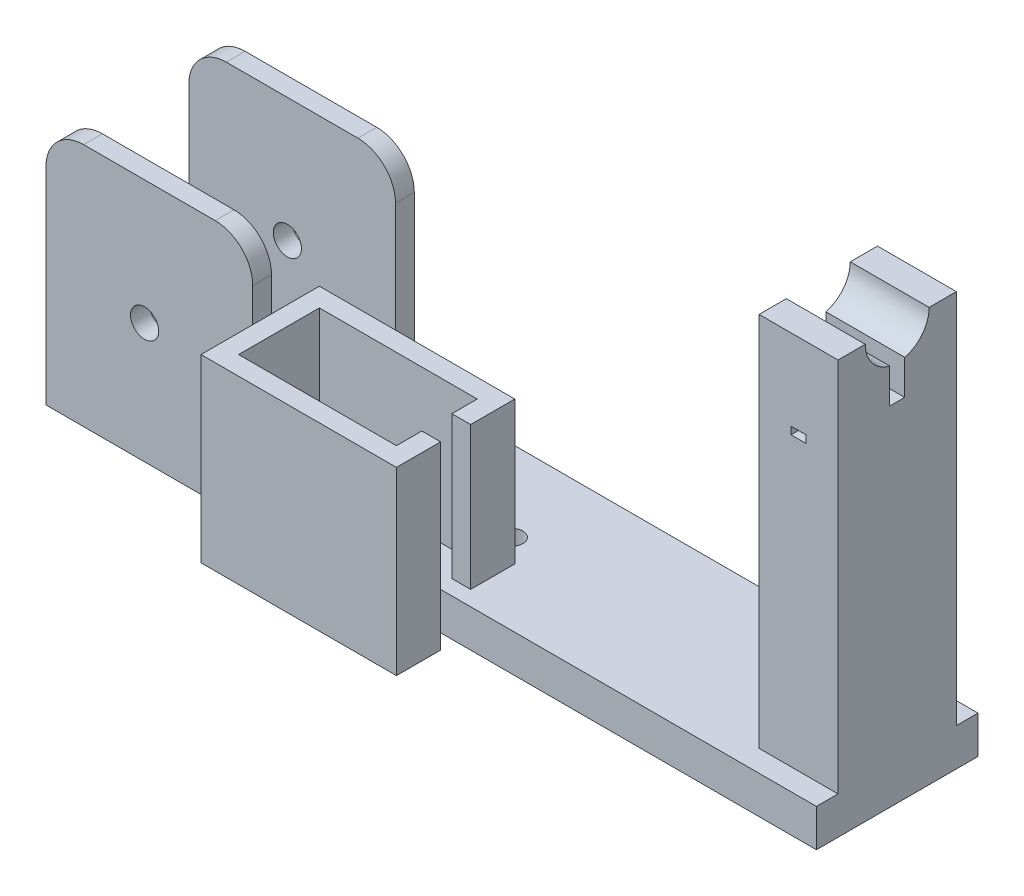
from build123d import *

# Parameters (mm, degrees)
SKETCH1_W           = 205
SKETCH1_H           = 43
BOSS_EXTRUDE1_DEPTH = 10
SKETCH4_W           = 55
SKETCH4_H           = 5
BOSS_EXTRUDE2_DEPTH = 55
SKETCH5_W           = 21
SKETCH5_H           = 31.5
BARREL_STAND_DEPTH  = 100
CUT_EXTRUDE4_DEPTH  = 21
SKETCH7_R           = 3.75
BOLT_HOLE_DEPTH     = 197.370661061
FILLET3_R           = 10
CUT_EXTRUDE9_DEPTH  = 2.8
SKETCH12_R          = 2.9
CUT_EXTRUDE10_DEPTH = 10
SKETCH13_W          = 4
SKETCH13_H          = 2
ZIP_TIE_SLOT_DEPTH  = 196.192210464
BOSS_EXTRUDE3_DEPTH = 38
BOSS_EXTRUDE4_DEPTH = 10


with BuildPart() as part:
    # Sketch1 → Boss-Extrude1 (new body)
    with BuildSketch(Plane(origin=(0, 0, 0), x_dir=(1, 0, 0), z_dir=(0, 1, 0))):
        with Locations((-54.3835126, 22.064427358)):
            Rectangle(SKETCH1_W, SKETCH1_H)
    extrude(amount=BOSS_EXTRUDE1_DEPTH)

    # Sketch4 → Boss-Extrude2 (add)
    with BuildSketch(Plane(origin=(0, 10, 0), x_dir=(1, 0, 0), z_dir=(0, 1, 0))):
        with Locations((-129.3835126, 3.064427358)):
            Rectangle(SKETCH4_W, SKETCH4_H)
    boss_extrude2 = extrude(amount=BOSS_EXTRUDE2_DEPTH)

    # Mirror1: Boss-Extrude2 across plane
    add(boss_extrude2.mirror(Plane.XY.offset(-22.064427358)))

    # Sketch5 → Barrel Stand (add)
    with BuildSketch(Plane(origin=(0, 10, 0), x_dir=(1, 0, 0), z_dir=(0, 1, 0))):
        with Locations((37.6164874, 22.064427358)):
            Rectangle(SKETCH5_W, SKETCH5_H)
    extrude(amount=BARREL_STAND_DEPTH)

    # Sketch6 → Cut-Extrude4 (cut)
    with BuildSketch(Plane(origin=(48.1164874, 0, 10.302060042), x_dir=(0, 0, 1), z_dir=(-1, 0, 0))):
        with BuildLine():
            Line((-34.3664874, 92.5), (-30.3664874, 92.5))
            Line((-30.3664874, 92.5), (-30.3664874, 101.738644179))
            ThreePointArc((-30.3664874, 101.738644179), (-32.3664874, 118.5), (-34.3664874, 101.738644179))
            Line((-34.3664874, 101.738644179), (-34.3664874, 92.5))
        make_face()
    extrude(amount=CUT_EXTRUDE4_DEPTH, mode=Mode.SUBTRACT)

    # Sketch7 → Bolt Hole (cut, through all)
    with BuildSketch(Plane.XY.offset(-0.564427358)):
        with Locations((-130.656969182, 32)):
            Circle(SKETCH7_R)
    extrude(amount=-BOLT_HOLE_DEPTH, mode=Mode.SUBTRACT)

    # Fillet3
    fillet3_edges = [part.edges().sort_by_distance(p)[0] for p in [
        (-156.8835126, 65, -3.064427358),
        (-101.8835126, 65, -3.064427358),
        (-156.8835126, 65, -41.064427358),
        (-101.8835126, 65, -41.064427358),
    ]]
    fillet(fillet3_edges, radius=FILLET3_R)

    # Sketch11 → Cut-Extrude9 (cut)
    # profile 1 of 2: a face of its own
    with BuildSketch(Plane.XZ):
        with BuildLine():
            Line((-40.210281565, -12.15972992), (-46.639894467, -20.689656856))
            ThreePointArc((-46.639894467, -20.689656856), (-47.433748895, -22.064427358), (-46.639894467, -23.43919786))
            Line((-46.639894467, -23.43919786), (-40.210281565, -31.969124796))
            ThreePointArc((-40.210281565, -31.969124796), (-40.489047819, -35.959259074), (-44.479189458, -36.237919954))
            Line((-44.479189458, -36.237919954), (-53.008957608, -29.808073492))
            ThreePointArc((-53.008957608, -29.808073492), (-54.3835126, -29.014191063), (-55.758067592, -29.808073492))
            Line((-55.758067592, -29.808073492), (-64.287835742, -36.237919954))
            ThreePointArc((-64.287835742, -36.237919954), (-68.277977381, -35.959259074), (-68.556743635, -31.969124796))
            Line((-68.556743635, -31.969124796), (-62.127130733, -23.43919786))
            ThreePointArc((-62.127130733, -23.43919786), (-61.333276305, -22.064427358), (-62.127130733, -20.689656856))
            Line((-62.127130733, -20.689656856), (-68.556743635, -12.15972992))
            ThreePointArc((-68.556743635, -12.15972992), (-68.277977381, -8.169595641), (-64.287835742, -7.890934761))
            Line((-64.287835742, -7.890934761), (-55.758067592, -14.320781224))
            ThreePointArc((-55.758067592, -14.320781224), (-54.3835126, -15.114663653), (-53.008957608, -14.320781224))
            Line((-53.008957608, -14.320781224), (-44.479189458, -7.890934761))
            ThreePointArc((-44.479189458, -7.890934761), (-40.489047819, -8.169595641), (-40.210281565, -12.15972992))
        make_face()
        with BuildLine():
            ThreePointArc((-52.857065356, -14.456741186), (-54.3835126, -15.314663653), (-55.909959844, -14.456741186))
            Line((-55.909959844, -14.456741186), (-64.40822508, -8.050642017))
            ThreePointArc((-64.40822508, -8.050642017), (-68.136557893, -8.311018864), (-68.3970332, -12.0393448))
            Line((-68.3970332, -12.0393448), (-61.991158458, -20.537779207))
            ThreePointArc((-61.991158458, -20.537779207), (-61.133276305, -22.064427358), (-61.991158458, -23.591075508))
            Line((-61.991158458, -23.591075508), (-68.3970332, -32.089509915))
            ThreePointArc((-68.3970332, -32.089509915), (-68.136557893, -35.817835851), (-64.40822508, -36.078212699))
            Line((-64.40822508, -36.078212699), (-55.909959844, -29.672113529))
            ThreePointArc((-55.909959844, -29.672113529), (-54.3835126, -28.814191063), (-52.857065356, -29.672113529))
            Line((-52.857065356, -29.672113529), (-44.35880012, -36.078212699))
            ThreePointArc((-44.35880012, -36.078212699), (-40.630467307, -35.817835851), (-40.369992, -32.089509915))
            Line((-40.369992, -32.089509915), (-46.775866742, -23.591075508))
            ThreePointArc((-46.775866742, -23.591075508), (-47.633748895, -22.064427358), (-46.775866742, -20.537779207))
            Line((-46.775866742, -20.537779207), (-40.369992, -12.0393448))
            ThreePointArc((-40.369992, -12.0393448), (-40.630467307, -8.311018864), (-44.35880012, -8.050642017))
            Line((-44.35880012, -8.050642017), (-52.857065356, -14.456741186))
        make_face(mode=Mode.SUBTRACT)
    # profile 2 of 2: a face of its own
    with BuildSketch(Plane.XZ):
        with BuildLine():
            Line((-44.35880012, -8.050642017), (-52.857065356, -14.456741186))
            ThreePointArc((-52.857065356, -14.456741186), (-54.3835126, -15.314663653), (-55.909959844, -14.456741186))
            Line((-55.909959844, -14.456741186), (-64.40822508, -8.050642017))
            ThreePointArc((-64.40822508, -8.050642017), (-68.136557893, -8.311018864), (-68.3970332, -12.0393448))
            Line((-68.3970332, -12.0393448), (-61.991158458, -20.537779207))
            ThreePointArc((-61.991158458, -20.537779207), (-61.133276305, -22.064427358), (-61.991158458, -23.591075508))
            Line((-61.991158458, -23.591075508), (-68.3970332, -32.089509915))
            ThreePointArc((-68.3970332, -32.089509915), (-68.136557893, -35.817835851), (-64.40822508, -36.078212699))
            Line((-64.40822508, -36.078212699), (-55.909959844, -29.672113529))
            ThreePointArc((-55.909959844, -29.672113529), (-54.3835126, -28.814191063), (-52.857065356, -29.672113529))
            Line((-52.857065356, -29.672113529), (-44.35880012, -36.078212699))
            ThreePointArc((-44.35880012, -36.078212699), (-40.630467307, -35.817835851), (-40.369992, -32.089509915))
            Line((-40.369992, -32.089509915), (-46.775866742, -23.591075508))
            ThreePointArc((-46.775866742, -23.591075508), (-47.633748895, -22.064427358), (-46.775866742, -20.537779207))
            Line((-46.775866742, -20.537779207), (-40.369992, -12.0393448))
            ThreePointArc((-40.369992, -12.0393448), (-40.630467307, -8.311018864), (-44.35880012, -8.050642017))
        make_face()
    extrude(amount=-CUT_EXTRUDE9_DEPTH, mode=Mode.SUBTRACT)

    # Sketch12 → Cut-Extrude10 (cut)
    with BuildSketch(Plane(origin=(0, 10, 0), x_dir=(1, 0, 0), z_dir=(0, 1, 0))):
        with Locations(Location((-54.3835126, 22.064427358, 0), (0, 0, 270))):
            Circle(SKETCH12_R)
    extrude(amount=-CUT_EXTRUDE10_DEPTH, mode=Mode.SUBTRACT)

    # Sketch13 → Zip Tie Slot (cut, through all)
    with BuildSketch(Plane.XY.offset(-6.314427358)):
        with Locations((37.6164874, 87.5)):
            Rectangle(SKETCH13_W, SKETCH13_H)
    extrude(amount=-ZIP_TIE_SLOT_DEPTH, mode=Mode.SUBTRACT)

    # Sketch14 → Boss-Extrude3 (add)
    with BuildSketch(Plane(origin=(0, 10, 0), x_dir=(1, 0, 0), z_dir=(0, 1, 0))):
        Polygon((-94.8835126, -10.185572642), (-52.8835126, -10.185572642), (-52.8835126, -3.435572642), (-47.8835126, -3.435572642), (-47.8835126, -15.185572642), (-99.8835126, -15.185572642), (-99.8835126, 16.314427358), (-47.8835126, 16.314427358), (-47.8835126, 4.564427358), (-52.8835126, 4.564427358), (-52.8835126, 11.314427358), (-94.8835126, 11.314427358), align=None)
    extrude(amount=BOSS_EXTRUDE3_DEPTH)

    # Sketch15 → Boss-Extrude4 (add)
    with BuildSketch(Plane.XZ.offset(-10)):
        Polygon((-47.8835126, 15.185572642), (-99.8835126, 15.185572642), (-99.8835126, -0.564427358), (-94.8835126, -0.564427358), (-94.8835126, 10.185572642), (-52.8835126, 10.185572642), (-52.8835126, 3.435572642), (-47.8835126, 3.435572642), align=None)
    extrude(amount=BOSS_EXTRUDE4_DEPTH)


solid = part.part
